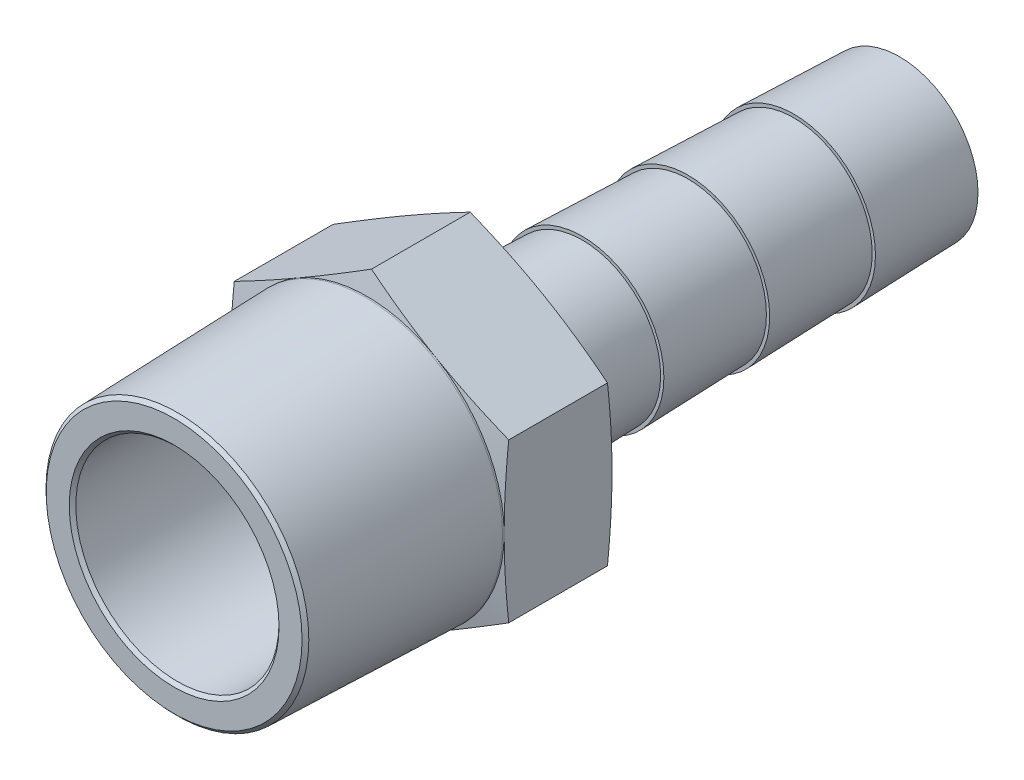
from build123d import *
from OCP.BRepFilletAPI import BRepFilletAPI_MakeChamfer

# Parameters (mm, degrees)
PIPESKETCH_R        = 10.668
PIPESKETCH_R_2      = 5.842
EXTRUSION_DEPTH     = 56.388
SKETCH1_R           = 5.842
BOSS_EXTRUDE1_DEPTH = 8.382
SKETCH9_R           = 7.8994
CUT_EXTRUDE1_DEPTH  = 14.986
CHAMFER1_SIZE       = 0.254
CHAMFER1_SIZE2      = 0.262273252


with BuildPart() as part:
    # PipeSketch → Extrusion (new body)
    with BuildSketch(Plane.XY):
        Circle(PIPESKETCH_R)
        Circle(PIPESKETCH_R_2, mode=Mode.SUBTRACT)
    extrude(amount=EXTRUSION_DEPTH)

    # Sketch1 → Boss-Extrude1 (add)
    with BuildSketch(Plane.XY.offset(33.02)):
        Polygon((10.668, 6.159172672), (0, 12.318345343), (-10.668, 6.159172672), (-10.668, -6.159172672), (0, -12.318345343), (10.668, -6.159172672), align=None)
        Circle(SKETCH1_R, mode=Mode.SUBTRACT)
    extrude(amount=BOSS_EXTRUDE1_DEPTH)

    # Sketch9 → Cut-Extrude1 (cut)
    with BuildSketch(Plane.XY.offset(56.388)):
        Circle(SKETCH9_R)
    extrude(amount=-CUT_EXTRUDE1_DEPTH, mode=Mode.SUBTRACT)

    # Sketch7 → Cut-Revolve7 (revolve, cut)
    with BuildSketch(Plane(origin=(0, 0, 0), x_dir=(0, 0, -1), z_dir=(1, 0, 0))):
        Polygon((-56.388, 10.668), (-56.388, 10.206228948), (-41.529, 10.668), align=None)
        Polygon((0, 10.668), (-33.02, 10.668), (-33.02, 6.35), (-32.893, 6.35), (-24.66975, 6.096), (-24.66975, 6.35), (-16.4465, 6.096), (-16.4465, 6.35), (-8.22325, 6.096), (-8.22325, 6.35), (0, 6.096), align=None)
    revolve(axis=Axis((0, 0, 0), (0, 0, -1)), mode=Mode.SUBTRACT)

    # Sketch4 → Cut-Revolve6 (revolve, cut)
    with BuildSketch(Plane(origin=(0, 0, 0), x_dir=(1, 0, 0), z_dir=(0, 1, 0))):
        Polygon((-10.668, -41.402), (-19.558, -41.402), (-19.558, -39.497), align=None)
        Polygon((-10.668, -33.02), (-19.558, -33.02), (-19.558, -34.925), align=None)
    revolve(axis=Axis((0, 0, 0), (0, 0, 1)), mode=Mode.SUBTRACT)

    # Chamfer1: one chamfer whose edges measure the first distance from different faces: ONE call of the kernel's chamfer builder (chamfer() names one face for all edges)
    chamfer1_edges_1 = [part.edges().sort_by_distance(p)[0] for p in [
        (0, -10.206228948, 56.388),
    ]]
    chamfer1_side_1 = [part.faces().sort_by_distance(p)[0] for p in [
        (0, -10.437114474, 48.9585),
    ]]
    chamfer1_edges_2 = [part.edges().sort_by_distance(p)[0] for p in [
        (-7.8994, 0, 56.388),
    ]]
    chamfer1 = BRepFilletAPI_MakeChamfer(part.part.solid().wrapped)
    for e in chamfer1_edges_1:
        chamfer1.Add(CHAMFER1_SIZE, CHAMFER1_SIZE2, e.wrapped, chamfer1_side_1[0].wrapped)  # the first distance lies on this face
    for e in chamfer1_edges_2:
        chamfer1.Add(CHAMFER1_SIZE, e.wrapped)
    add(Compound.cast(chamfer1.Shape()), mode=Mode.REPLACE)


solid = part.part
